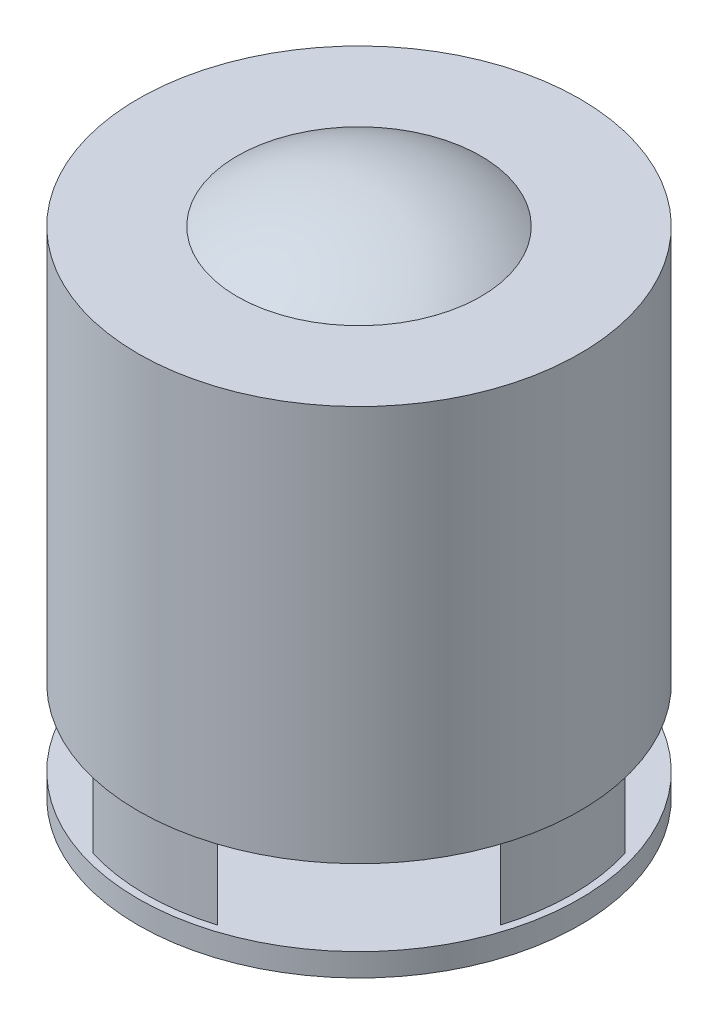
from build123d import *

# Parameters (mm, degrees)
CROQUIS1_R              = 29
SALIENTE_EXTRUIR1_DEPTH = 52
SALIENTE_EXTRUIR2_DEPTH = 10
SALIENTE_EXTRUIR3_START = 3
CROQUIS3_R              = 29
SALIENTE_EXTRUIR3_DEPTH = 3
CROQUIS6_R              = 16
SALIENTE_EXTRUIR4_DEPTH = 0.001
C_PULA1_FACE_RADIUS     = 16
C_PULA1_HEIGHT          = 5
CROQUIS7_R              = 2.05
CORTAR_EXTRUIR1_DEPTH   = 3


with BuildPart() as part:
    # Croquis1 → Saliente-Extruir1 (new body)
    with BuildSketch(Plane(origin=(0, 0, 0), x_dir=(1, 0, 0), z_dir=(0, 1, 0))):
        with Locations(Location((0, 0, 0), (0, 0, 90))):
            Circle(CROQUIS1_R)
    extrude(amount=SALIENTE_EXTRUIR1_DEPTH)

    # Croquis2 → Saliente-Extruir2 (add)
    with BuildSketch(Plane.XZ):
        with BuildLine():
            Line((25.4355, 6), (25.4355, -6))
            Line((25.4355, -6), (26.777981394, -8.18680125))
            ThreePointArc((26.777981394, -8.18680125), (28.0015, 0), (26.777981394, 8.18680125))
            Line((26.777981394, 8.18680125), (25.4355, 6))
        make_face()
        with BuildLine():
            Line((-6, 25.4355), (6, 25.4355))
            Line((6, 25.4355), (8.18680125, 26.777981394))
            ThreePointArc((8.18680125, 26.777981394), (0, 28.0015), (-8.18680125, 26.777981394))
            Line((-8.18680125, 26.777981394), (-6, 25.4355))
        make_face()
        with BuildLine():
            Line((6, -25.4355), (-6, -25.4355))
            Line((-6, -25.4355), (-8.18680125, -26.777981394))
            ThreePointArc((-8.18680125, -26.777981394), (0, -28.0015), (8.18680125, -26.777981394))
            Line((8.18680125, -26.777981394), (6, -25.4355))
        make_face()
        with BuildLine():
            Line((-25.4355, -6), (-25.4355, 6))
            Line((-25.4355, 6), (-26.777981394, 8.18680125))
            ThreePointArc((-26.777981394, 8.18680125), (-28.0015, 0), (-26.777981394, -8.18680125))
            Line((-26.777981394, -8.18680125), (-25.4355, -6))
        make_face()
    extrude(amount=SALIENTE_EXTRUIR2_DEPTH)

    # Croquis3 → Saliente-Extruir3 (add)
    with BuildSketch(Plane.XZ.offset(10).offset(SALIENTE_EXTRUIR3_START)):
        with Locations(Location((0, 0, 0), (0, 0, 270))):
            Circle(CROQUIS3_R)
    extrude(amount=-SALIENTE_EXTRUIR3_DEPTH)

    # Croquis6 → Saliente-Extruir4 (add)
    with BuildSketch(Plane(origin=(0, 52, 0), x_dir=(1, 0, 0), z_dir=(0, 1, 0))):
        with Locations(Location((0, 0, 0), (0, 0, 270))):
            Circle(CROQUIS6_R)
    extrude(amount=SALIENTE_EXTRUIR4_DEPTH)

    # Cúpula1: a dome of height H over a round flat face of radius A is a cap of a sphere of radius (A * A + H * H) / (2 * H)
    c_pula1_r = (C_PULA1_FACE_RADIUS * C_PULA1_FACE_RADIUS + C_PULA1_HEIGHT * C_PULA1_HEIGHT) / (2 * C_PULA1_HEIGHT)
    c_pula1_base = Plane((0, 52.001, 0), z_dir=(0, 1, 0))
    with Locations(c_pula1_base.offset(C_PULA1_HEIGHT - c_pula1_r)):
        c_pula1_ball = Sphere(c_pula1_r, mode=Mode.PRIVATE)
    add(split(c_pula1_ball, bisect_by=c_pula1_base, keep=Keep.TOP, mode=Mode.PRIVATE))

    # Croquis7 → Cortar-Extruir1 (cut)
    with BuildSketch(Plane.XZ.offset(13)):
        with Locations(Location((0, 12, 0), (0, 0, 270))):
            Circle(CROQUIS7_R)
        with Locations(Location((10.392304845, -6, 0), (0, 0, 270))):
            Circle(CROQUIS7_R)
        with Locations(Location((-10.392304845, -6, 0), (0, 0, 270))):
            Circle(CROQUIS7_R)
    extrude(amount=-CORTAR_EXTRUIR1_DEPTH, mode=Mode.SUBTRACT)


solid = part.part
